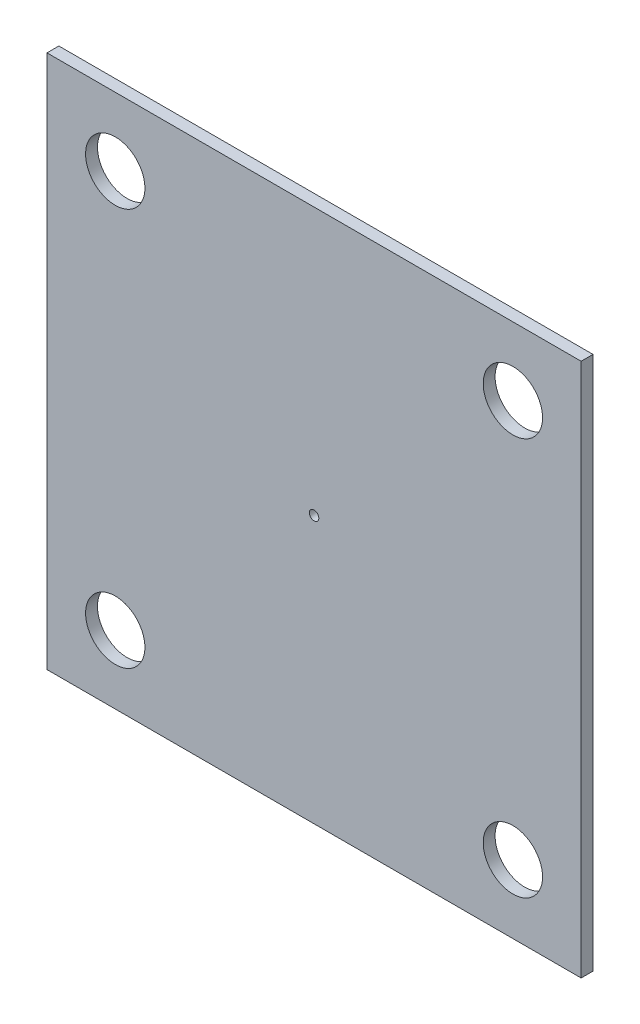
from build123d import *

# Parameters (mm, degrees)
SKETCH1_W           = 450
SKETCH1_H           = 450
SKETCH1_R           = 4
SKETCH1_R_2         = 25
BOSS_EXTRUDE1_DEPTH = 5


with BuildPart() as part:
    # Sketch1 → Boss-Extrude1 (new, symmetric)
    with BuildSketch(Plane.XY):
        Rectangle(SKETCH1_W, SKETCH1_H)
        Circle(SKETCH1_R, mode=Mode.SUBTRACT)
        with Locations((-167.5, -167.5)):
            Circle(SKETCH1_R_2, mode=Mode.SUBTRACT)
        with Locations((167.5, -167.5)):
            Circle(SKETCH1_R_2, mode=Mode.SUBTRACT)
        with Locations((167.5, 167.5)):
            Circle(SKETCH1_R_2, mode=Mode.SUBTRACT)
        with Locations((-167.5, 167.5)):
            Circle(SKETCH1_R_2, mode=Mode.SUBTRACT)
    extrude(amount=BOSS_EXTRUDE1_DEPTH, both=True)


solid = part.part
